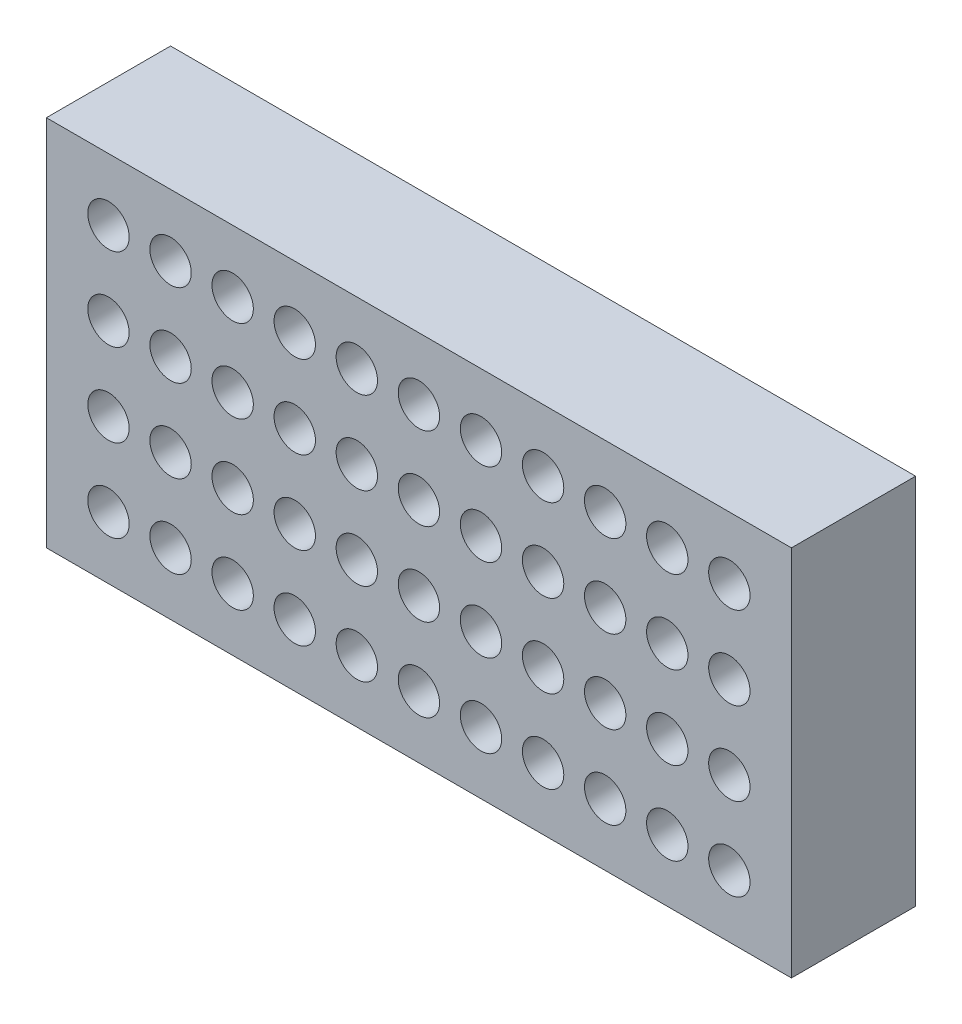
from build123d import *

# Parameters (mm, degrees)
ESBO_O1_W                = 180
ESBO_O1_H                = 90
RESSALTO_EXTRUS_O1_DEPTH = 30
ESBO_O2_R                = 5
CORTE_EXTRUS_O1_DEPTH    = 30


with BuildPart() as part:
    # Esboço1 → Ressalto-extrusão1 (new body)
    with BuildSketch(Plane.XY):
        Rectangle(ESBO_O1_W, ESBO_O1_H)
    extrude(amount=RESSALTO_EXTRUS_O1_DEPTH)

    # Esboço2 → Corte-extrusão1 (cut)
    with BuildSketch(Plane.XY.offset(30)):
        with Locations((-75, 30)):
            Circle(ESBO_O2_R)
        with Locations((-60, 30)):
            Circle(ESBO_O2_R)
        with Locations((-45, 30)):
            Circle(ESBO_O2_R)
        with Locations((-30, 30)):
            Circle(ESBO_O2_R)
        with Locations((-15, 30)):
            Circle(ESBO_O2_R)
        with Locations((0, 30)):
            Circle(ESBO_O2_R)
        with Locations((15, 30)):
            Circle(ESBO_O2_R)
        with Locations((30, 30)):
            Circle(ESBO_O2_R)
        with Locations((45, 30)):
            Circle(ESBO_O2_R)
        with Locations((60, 30)):
            Circle(ESBO_O2_R)
        with Locations((75, 30)):
            Circle(ESBO_O2_R)
        with Locations((-60, 10)):
            Circle(ESBO_O2_R)
        with Locations((-45, 10)):
            Circle(ESBO_O2_R)
        with Locations((-30, 10)):
            Circle(ESBO_O2_R)
        with Locations((-15, 10)):
            Circle(ESBO_O2_R)
        with Locations((0, 10)):
            Circle(ESBO_O2_R)
        with Locations((15, 10)):
            Circle(ESBO_O2_R)
        with Locations((30, 10)):
            Circle(ESBO_O2_R)
        with Locations((45, 10)):
            Circle(ESBO_O2_R)
        with Locations((60, 10)):
            Circle(ESBO_O2_R)
        with Locations((75, 10)):
            Circle(ESBO_O2_R)
        with Locations((-60, -10)):
            Circle(ESBO_O2_R)
        with Locations((-45, -10)):
            Circle(ESBO_O2_R)
        with Locations((-30, -10)):
            Circle(ESBO_O2_R)
        with Locations((-15, -10)):
            Circle(ESBO_O2_R)
        with Locations((0, -10)):
            Circle(ESBO_O2_R)
        with Locations((15, -10)):
            Circle(ESBO_O2_R)
        with Locations((30, -10)):
            Circle(ESBO_O2_R)
        with Locations((45, -10)):
            Circle(ESBO_O2_R)
        with Locations((60, -10)):
            Circle(ESBO_O2_R)
        with Locations((75, -10)):
            Circle(ESBO_O2_R)
        with Locations((-60, -30)):
            Circle(ESBO_O2_R)
        with Locations((-45, -30)):
            Circle(ESBO_O2_R)
        with Locations((-30, -30)):
            Circle(ESBO_O2_R)
        with Locations((-15, -30)):
            Circle(ESBO_O2_R)
        with Locations((0, -30)):
            Circle(ESBO_O2_R)
        with Locations((15, -30)):
            Circle(ESBO_O2_R)
        with Locations((30, -30)):
            Circle(ESBO_O2_R)
        with Locations((45, -30)):
            Circle(ESBO_O2_R)
        with Locations((60, -30)):
            Circle(ESBO_O2_R)
        with Locations((75, -30)):
            Circle(ESBO_O2_R)
        with Locations((-75, 10)):
            Circle(ESBO_O2_R)
        with Locations((-75, -10)):
            Circle(ESBO_O2_R)
        with Locations((-75, -30)):
            Circle(ESBO_O2_R)
    extrude(amount=-CORTE_EXTRUS_O1_DEPTH, mode=Mode.SUBTRACT)


solid = part.part
